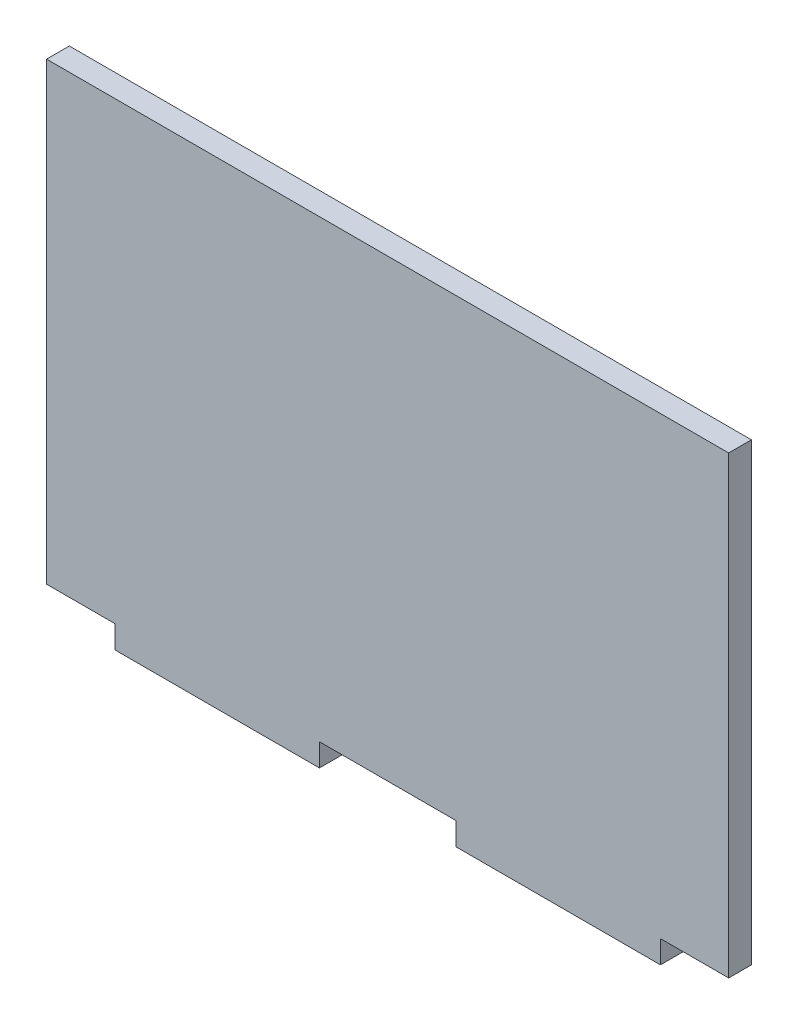
from build123d import *

# Parameters (mm, degrees)
SALIENTE_EXTRUIR1_DEPTH = 5


with BuildPart() as part:
    # Croquis1 → Saliente-Extruir1 (new body)
    with BuildSketch(Plane.XY):
        Polygon((0, 0), (15, 0), (15, -5), (60, -5), (60, 0), (90, 0), (90, -5), (135, -5), (135, 0), (150, 0), (150, 100), (0, 100), (0, 87.5), (0, 62.5), (0, 37.5), (0, 12.5), align=None)
    extrude(amount=SALIENTE_EXTRUIR1_DEPTH)


solid = part.part
